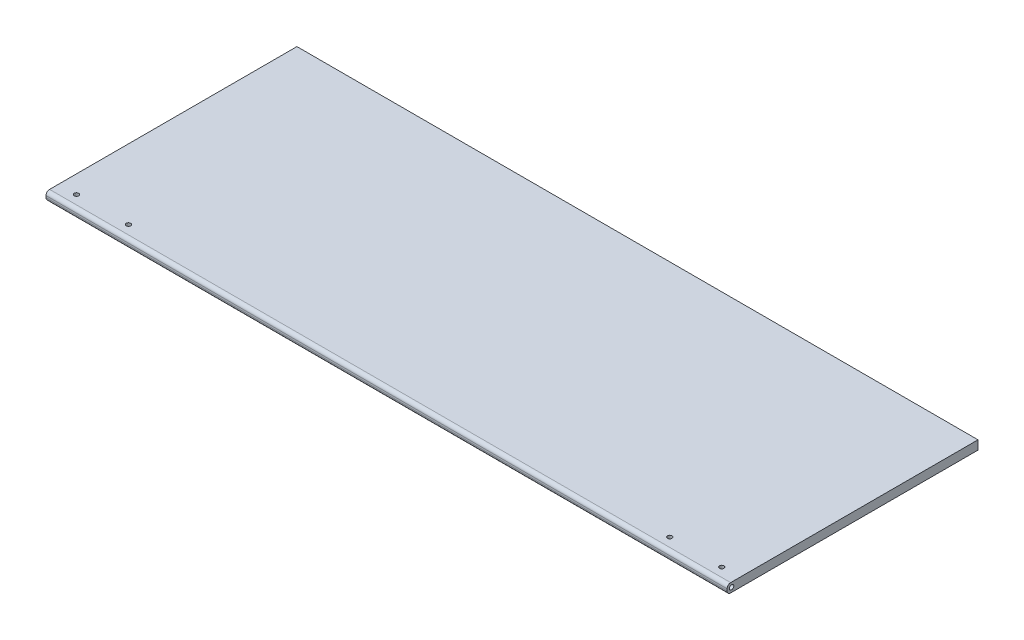
from build123d import *

# Parameters (mm, degrees)
SKETCH1_W           = 482.6
SKETCH1_H           = 177.8
BOSS_EXTRUDE1_DEPTH = 6.35
SKETCH2_R           = 1.5875
CUT_EXTRUDE1_DEPTH  = 491.760932125
FILLET1_R           = 2.54
SKETCH4_R           = 1.5875
CUT_EXTRUDE3_DEPTH  = 258.233789577
SCALE1_SCALE        = 0.25


with BuildPart() as part:
    # Sketch1 → Boss-Extrude1 (new body)
    with BuildSketch(Plane(origin=(0, 0, 0), x_dir=(1, 0, 0), z_dir=(0, 1, 0))):
        Rectangle(SKETCH1_W, SKETCH1_H)
    extrude(amount=BOSS_EXTRUDE1_DEPTH)

    # Sketch2 → Cut-Extrude1 (cut, through all)
    with BuildSketch(Plane.ZY.offset(241.3)):
        with Locations((85.725, 3.175)):
            Circle(SKETCH2_R)
    extrude(amount=-CUT_EXTRUDE1_DEPTH, mode=Mode.SUBTRACT)

    # Fillet1
    fillet1_edges = [part.edges().sort_by_distance(p)[0] for p in [
        (0, 6.35, 88.9),
        (0, 0, 88.9),
    ]]
    fillet(fillet1_edges, radius=FILLET1_R)

    # Sketch4 → Cut-Extrude3 (cut, through all)
    with BuildSketch(Plane.XZ):
        with Locations(Location((-191.77, 80.01, 0), (0, 0, 270))):
            Circle(SKETCH4_R)
        with Locations(Location((-228.6, 80.01, 0), (0, 0, 270))):
            Circle(SKETCH4_R)
    cut_extrude3 = extrude(amount=-CUT_EXTRUDE3_DEPTH, mode=Mode.SUBTRACT)

    # Mirror1: Cut-Extrude3 across plane
    add(cut_extrude3.mirror(Plane(origin=(0, 0, 0), x_dir=(0, 0, 1), z_dir=(1, 0, 0))), mode=Mode.SUBTRACT)


with BuildPart() as part_1:
    # Scale1: scaled about (0, 3.175, -0.855734496)
    add(part.part.scale(SCALE1_SCALE).moved(Location((0, 2.38125, -0.641800872))))


solid = part_1.part
